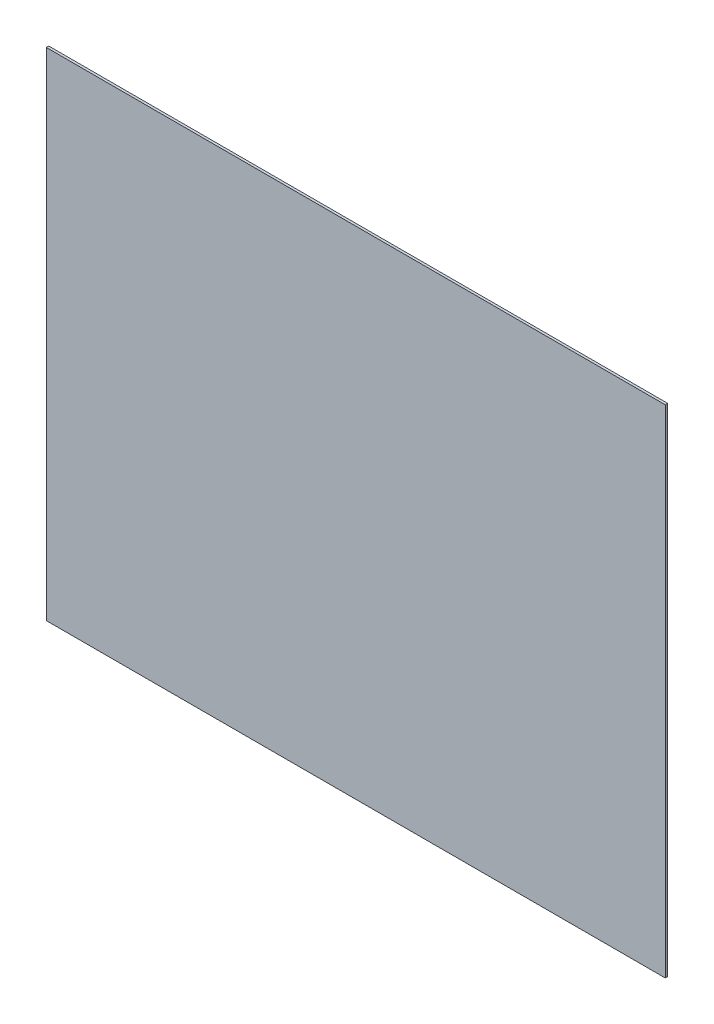
from build123d import *

# Parameters (mm, degrees)
SKETCH1_W           = 505
SKETCH1_H           = 405
BOSS_EXTRUDE1_DEPTH = 2


with BuildPart() as part:
    # Sketch1 → Boss-Extrude1 (new body)
    with BuildSketch(Plane(origin=(0, 0, -405), x_dir=(-1, 0, 0), z_dir=(0, 0, -1))):
        with Locations((-152.5, -167.5)):
            Rectangle(SKETCH1_W, SKETCH1_H)
    extrude(amount=-BOSS_EXTRUDE1_DEPTH)


solid = part.part
